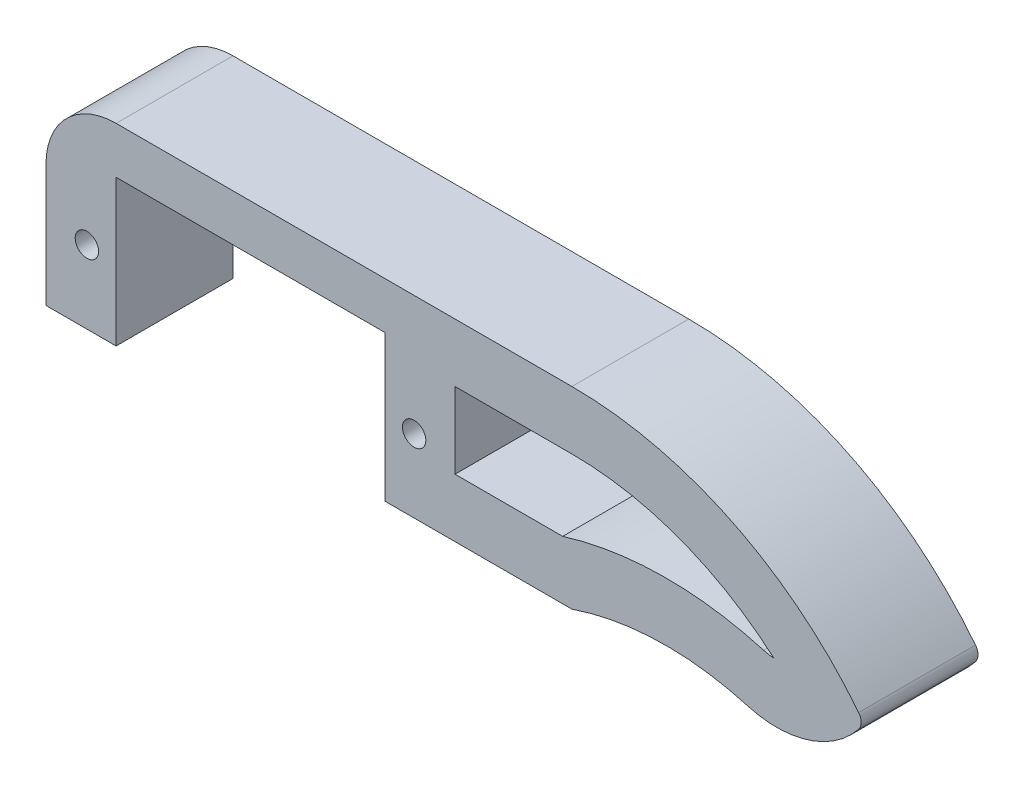
from build123d import *

# Parameters (mm, degrees)
CROQUIS1_R              = 1
SALIENTE_EXTRUIR1_DEPTH = 10
SALIENTE_EXTRUIR2_DEPTH = 10
REDONDEO1_R             = 1
REDONDEO2_R             = 6


with BuildPart() as part:
    # Croquis1 → Saliente-Extruir1 (new body)
    with BuildSketch(Plane.XY):
        Polygon((0, 0), (6, 0), (6, 12.5), (29, 12.5), (29, 0), (35, 0), (35, 16.5), (0, 16.5), align=None)
        with Locations((3.5, 6.25)):
            Circle(CROQUIS1_R, mode=Mode.SUBTRACT)
        with Locations((31.5, 6.25)):
            Circle(CROQUIS1_R, mode=Mode.SUBTRACT)
    extrude(amount=-SALIENTE_EXTRUIR1_DEPTH)

    # Croquis4 → Saliente-Extruir2 (add, through all)
    with BuildSketch(Plane.XY):
        with BuildLine():
            Line((45, 11.5), (35, 11.5))
            Line((35, 11.5), (35, 16.5))
            Line((35, 16.5), (45, 16.5))
            ThreePointArc((45, 16.5), (58.975424859, 13.200849719), (70, 4))
            ThreePointArc((70, 4), (65.603760626, 0.546008902), (60.016254104, 0.354316441))
            ThreePointArc((60.016254104, 0.354316441), (52.480888042, 1.331572321), (45, 0))
            Line((45, 0), (35, 0))
            Line((35, 0), (35, 5))
            Line((35, 5), (44.209457127, 5))
            ThreePointArc((44.209457127, 5), (52.795894624, 6.337270923), (61.405382505, 5.157473974))
            ThreePointArc((61.405382505, 5.157473974), (61.84041484, 5.057582168), (62.283868073, 5.006781226))
            ThreePointArc((62.283868073, 5.006781226), (54.231657294, 9.823135811), (45, 11.5))
        make_face()
    extrude(amount=-SALIENTE_EXTRUIR2_DEPTH)

    # Redondeo1
    redondeo1_edges = [part.edges().sort_by_distance(p)[0] for p in [
        (70, 4, -5),
    ]]
    fillet(redondeo1_edges, radius=REDONDEO1_R)

    # Redondeo2
    redondeo2_edges = [part.edges().sort_by_distance(p)[0] for p in [
        (0, 16.5, -5),
    ]]
    fillet(redondeo2_edges, radius=REDONDEO2_R)


solid = part.part
